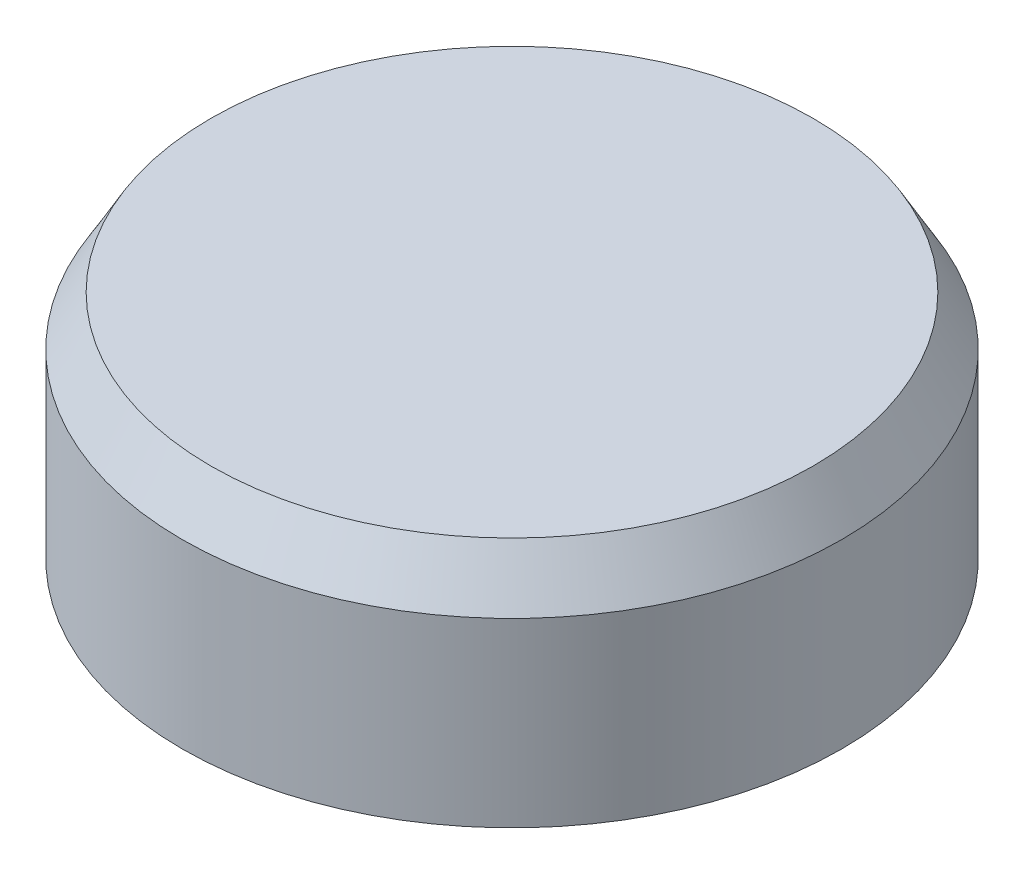
from build123d import *

# Parameters (mm, degrees)
SKETCH1_R           = 10
BOSS_EXTRUDE1_DEPTH = 3
SKETCH2_R           = 3
BOSS_EXTRUDE2_DEPTH = 5.5
FILLET1_R           = 0.5
CUT_EXTRUDE1_DEPTH  = 4.5
CHAMFER1_SIZE       = 1.5
CHAMFER1_SIZE2      = 0.866025404
CUT_EXTRUDE2_DEPTH  = 2
BOSS_EXTRUDE3_START = 4
SKETCH5_R           = 10
SKETCH5_R_2         = 8.5
BOSS_EXTRUDE3_DEPTH = 4
CHAMFER2_SIZE       = 1
FILLET2_R           = 0.5


with BuildPart() as part:
    # Sketch1 → Boss-Extrude1 (new body)
    with BuildSketch(Plane(origin=(0, 0, 0), x_dir=(1, 0, 0), z_dir=(0, 1, 0))):
        with Locations(Location((0, 0, 0), (0, 0, 270))):
            Circle(SKETCH1_R)
    extrude(amount=BOSS_EXTRUDE1_DEPTH)

    # Sketch2 → Boss-Extrude2 (add)
    with BuildSketch(Plane.XZ):
        with Locations(Location((0, 0, 0), (0, 0, 90))):
            Circle(SKETCH2_R)
    extrude(amount=BOSS_EXTRUDE2_DEPTH)

    # Fillet1
    fillet1_edges = [part.edges().sort_by_distance(p)[0] for p in [
        (0, 0, -3),
    ]]
    fillet(fillet1_edges, radius=FILLET1_R)

    # Sketch3 → Cut-Extrude1 (cut)
    with BuildSketch(Plane.XZ.offset(5.5)):
        Polygon((0.6, 0.6), (2.5, 0.6), (2.5, -0.6), (0.6, -0.6), (0.6, -2.5), (-0.6, -2.5), (-0.6, -0.6), (-2.5, -0.6), (-2.5, 0.6), (-0.6, 0.6), (-0.6, 2.5), (0.6, 2.5), align=None)
    extrude(amount=-CUT_EXTRUDE1_DEPTH, mode=Mode.SUBTRACT)

    # Chamfer1
    chamfer1_edges = [part.edges().sort_by_distance(p)[0] for p in [
        (0, 3, -10),
    ]]
    chamfer1_side = [part.faces().sort_by_distance(p)[0] for p in [
        (0, 1.5, -10),
    ]]
    chamfer(chamfer1_edges, length=CHAMFER1_SIZE, length2=CHAMFER1_SIZE2, reference=chamfer1_side[0])

    # Sketch4 → Cut-Extrude2 (cut)
    with BuildSketch(Plane.XZ):
        with BuildLine():
            Line((-0.785080982, 5.948112159), (-0.3672174, 5.548693088))
            add(Edge.make_bspline(
                [(-0.3672174, 5.548693088), (-0.331770807, 5.585344925), (-0.262532505, 5.656937445), (-0.150963545, 5.751719632), (-0.034935889, 5.830707761), (0.083293377, 5.89723106), (0.205850855, 5.947560676), (0.331319446, 5.984236716), (0.460500303, 6.006596711), (0.547924939, 6.00915509), (0.591897183, 6.010441886)],
                knots=[0, 0, 0, 0, 1.115251505, 2.178435587, 3.19620269, 4.182487026, 5.141301733, 6.088180966, 7.038406374, 8, 8, 8, 8], degree=3))
            add(Edge.make_bspline(
                [(0.591897183, 6.010441886), (0.62861935, 6.009425272), (0.701086501, 6.007419097), (0.807487269, 5.992711853), (0.909265103, 5.967701544), (1.006768403, 5.933232705), (1.099710263, 5.888631858), (1.188285547, 5.833933521), (1.272275875, 5.769631699), (1.350571785, 5.696059092), (1.422194132, 5.615675491), (1.485477036, 5.529906379), (1.538486619, 5.438948251), (1.581990722, 5.343722262), (1.615878736, 5.24378766), (1.640079036, 5.139211724), (1.654075842, 5.029869914), (1.65616496, 4.955540165), (1.65722671, 4.917763601)],
                knots=[0, 0, 0, 0, 1.035432265, 2.043311493, 3.022114605, 3.98653278, 4.95457646, 5.923598177, 6.917315552, 7.932509744, 8.948865224, 9.949768934, 10.933144597, 11.912367597, 12.897413939, 13.903909035, 14.934704909, 16, 16, 16, 16], degree=3))
            add(Edge.make_bspline(
                [(1.65722671, 4.917763601), (1.656920726, 4.891249365), (1.656317624, 4.83898926), (1.64971561, 4.761682062), (1.639084809, 4.686675803), (1.623699408, 4.614084098), (1.604459812, 4.543844039), (1.581887385, 4.475349668), (1.553570607, 4.409547423), (1.522138557, 4.345673054), (1.485583444, 4.285469453), (1.446170289, 4.228060322), (1.403433158, 4.173727077), (1.357095239, 4.122691832), (1.306504383, 4.075752155), (1.252968178, 4.031496513), (1.195583542, 3.991032776), (1.135542498, 3.95334546), (1.072326368, 3.920606168), (1.007650353, 3.890950695), (0.940533833, 3.866866041), (0.871793993, 3.847451613), (0.801676484, 3.830942542), (0.729495493, 3.820777399), (0.655876737, 3.813079455), (0.606122815, 3.812604152), (0.581084883, 3.812364963)],
                knots=[0, 0, 0, 0, 1.103660481, 2.175337485, 3.227646561, 4.255952547, 5.262355991, 6.258840057, 7.255597736, 8.242457506, 9.22035537, 10.185017736, 11.140346927, 12.096287581, 13.051739095, 14.01125915, 14.986044842, 15.97314143, 16.960198552, 17.947847494, 18.933482797, 19.925264591, 20.920966487, 21.929612487, 22.958107872, 24, 24, 24, 24], degree=3))
            add(Edge.make_bspline(
                [(0.581084883, 3.812364963), (0.53861625, 3.813593381), (0.455176427, 3.816006904), (0.332716491, 3.834880308), (0.216024371, 3.865925989), (0.122787926, 3.902589134), (0.049739634, 3.938794467), (-0.005870951, 3.972282616), (-0.06337663, 4.009742788), (-0.121822283, 4.05258877), (-0.181865308, 4.100306392), (-0.242445806, 4.153940761), (-0.30511465, 4.211725773), (-0.346168388, 4.252968071), (-0.3672174, 4.274113761)],
                knots=[0, 0, 0, 0, 1.404581149, 2.759636711, 4.088442092, 5.392261763, 6.066678138, 6.783632037, 7.538459478, 8.336747902, 9.180226004, 10.074962426, 11.012997595, 12, 12, 12, 12], degree=3))
            Line((-0.3672174, 4.274113761), (-0.772360629, 3.848617968))
            add(Edge.make_bspline(
                [(-0.772360629, 3.848617968), (-0.743881241, 3.821122013), (-0.688295566, 3.767455788), (-0.604446117, 3.691254757), (-0.520702197, 3.62277966), (-0.439086883, 3.55954515), (-0.358263232, 3.503393403), (-0.278239814, 3.454268339), (-0.19992253, 3.410927515), (-0.121685097, 3.374101852), (-0.04304068, 3.342833039), (0.037875183, 3.315912643), (0.12130986, 3.293138957), (0.207772931, 3.274763583), (0.296457921, 3.260029014), (0.388194805, 3.250083265), (0.482401925, 3.243397069), (0.546304074, 3.242796259), (0.578540813, 3.242493168)],
                knots=[0, 0, 0, 0, 1.244526981, 2.429050516, 3.560637417, 4.644440555, 5.67424972, 6.652764056, 7.595344123, 8.486817594, 9.369275933, 10.254498637, 11.166417451, 12.086725134, 13.032340136, 13.991389299, 14.986715468, 16, 16, 16, 16], degree=3))
            add(Edge.make_bspline(
                [(0.578540813, 3.242493168), (0.63775571, 3.244002674), (0.753622802, 3.246956357), (0.923423006, 3.26884115), (1.084728641, 3.305530621), (1.237932135, 3.357419651), (1.382984771, 3.423705456), (1.519849442, 3.504968741), (1.648305552, 3.6009936), (1.767315427, 3.710654531), (1.874965524, 3.831765824), (1.970115743, 3.961806126), (2.048824007, 4.101414539), (2.114177176, 4.248528599), (2.165282494, 4.403819647), (2.201251974, 4.567455659), (2.223434089, 4.739278634), (2.225860844, 4.856637687), (2.227098505, 4.916491566)],
                knots=[0, 0, 0, 0, 1.078019885, 2.10938526, 3.111377082, 4.085535484, 5.04941344, 6.010039228, 6.978205633, 7.964457913, 8.951525778, 9.924444315, 10.892603023, 11.863865945, 12.85144698, 13.863884204, 14.910567087, 16, 16, 16, 16], degree=3))
            add(Edge.make_bspline(
                [(2.227098505, 4.916491566), (2.22657553, 4.955527754), (2.22553912, 5.03288794), (2.21464636, 5.146845761), (2.199461218, 5.257934252), (2.175371372, 5.364999947), (2.146333439, 5.469485219), (2.110220954, 5.570254434), (2.067091593, 5.667597213), (2.018335518, 5.761676514), (1.963178258, 5.851876016), (1.901561543, 5.937420765), (1.835071629, 6.018971149), (1.76211087, 6.095445251), (1.683739482, 6.16751453), (1.599603627, 6.234788426), (1.510209341, 6.298231725), (1.415314666, 6.356208377), (1.316763153, 6.408651341), (1.215797795, 6.454908275), (1.112666654, 6.493568419), (1.007805777, 6.525635583), (0.900772127, 6.549571453), (0.792329685, 6.567690134), (0.681555734, 6.577818593), (0.607180623, 6.579476687), (0.569636566, 6.580313681)],
                knots=[0, 0, 0, 0, 1.071919942, 2.124283339, 3.142214191, 4.149696895, 5.136002878, 6.119640489, 7.086990633, 8.058538607, 9.028339693, 9.988281803, 10.952401235, 11.916291999, 12.888973767, 13.874849856, 14.873389453, 15.898127285, 16.927174885, 17.938320013, 18.946391617, 19.950418109, 20.947802303, 21.956882652, 22.968648068, 24, 24, 24, 24], degree=3))
            add(Edge.make_bspline(
                [(0.569636566, 6.580313681), (0.537607636, 6.579833895), (0.473882787, 6.578879311), (0.378985793, 6.570921817), (0.284847742, 6.558424654), (0.191805675, 6.539569095), (0.099194061, 6.517185164), (0.00822992, 6.487876495), (-0.082521756, 6.455206459), (-0.171637662, 6.416156102), (-0.259242191, 6.37352911), (-0.343283069, 6.32516724), (-0.425171333, 6.274046627), (-0.503092391, 6.217141729), (-0.578505869, 6.156516593), (-0.651017426, 6.091888368), (-0.71999073, 6.022179512), (-0.763274545, 5.97292609), (-0.785080982, 5.948112159)],
                knots=[0, 0, 0, 0, 0.996412454, 1.982464992, 2.961075852, 3.949442424, 4.934965278, 5.923860011, 6.921385422, 7.934793307, 8.949617135, 9.951082467, 10.950285876, 11.951772932, 12.951063433, 13.960125323, 14.972308753, 16, 16, 16, 16], degree=3))
        make_face()
        Polygon((-1.314247649, 6.580313681), (-1.884119443, 6.580313681), (-1.884119443, 5.644095732), (-2.250465597, 5.644095732), (-2.250465597, 5.155634194), (-1.884119443, 5.155634194), (-1.884119443, 3.323903425), (-1.314247649, 3.323903425), (-1.314247649, 5.155634194), (-1.029311751, 5.155634194), (-1.029311751, 5.644095732), (-1.314247649, 5.644095732), align=None)
    extrude(amount=-CUT_EXTRUDE2_DEPTH, mode=Mode.SUBTRACT)

    # Sketch5 → Boss-Extrude3 (add)
    with BuildSketch(Plane.XZ.offset(BOSS_EXTRUDE3_START)):
        with Locations(Location((0, 0, 0), (0, 0, 270))):
            Circle(SKETCH5_R)
        with Locations(Location((0, 0, 0), (0, 0, 270))):
            Circle(SKETCH5_R_2, mode=Mode.SUBTRACT)
    extrude(amount=-BOSS_EXTRUDE3_DEPTH)

    # Chamfer2
    chamfer2_edges = [part.edges().sort_by_distance(p)[0] for p in [
        (0, -4, 8.5),
    ]]
    chamfer(chamfer2_edges, length=CHAMFER2_SIZE)

    # Fillet2
    fillet2_edges = [part.edges().sort_by_distance(p)[0] for p in [
        (1.55, -5.5, -0.6),
        (1.55, -5.5, 0.6),
        (0.6, -5.5, 1.55),
        (-0.6, -5.5, 1.55),
        (-1.55, -5.5, 0.6),
        (-1.55, -5.5, -0.6),
        (-0.6, -5.5, -1.55),
        (0.6, -5.5, -1.55),
    ]]
    fillet(fillet2_edges, radius=FILLET2_R)


solid = part.part
